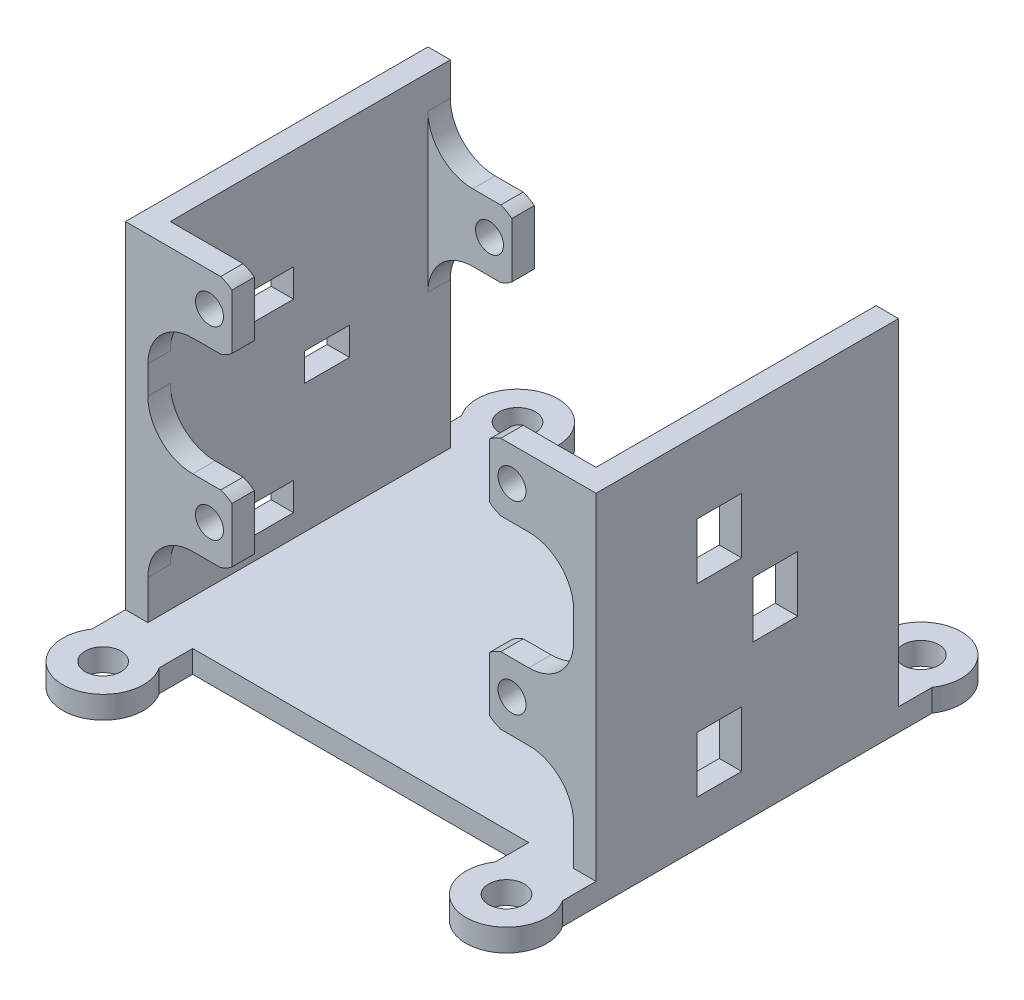
from build123d import *

# Parameters (mm, degrees)
SKETCH_1_W                       = 42
SKETCH_1_H                       = 27
EXTRUDE_1_DEPTH                  = 2
SKETCH_2_W                       = 27
SKETCH_2_H                       = 30
SKETCH_2_W_2                     = 4
SKETCH_2_H_2                     = 5
EXTRUDE_2_DEPTH                  = 2
SKETCH_3_W                       = 4
SKETCH_3_H                       = 2.5
EXTRUDE_3_DEPTH                  = 2
SKETCH_4_R                       = 1.25
EXTRUDE_4_DEPTH                  = 2
PATTERN_LINEAR_1_COUNT           = 2
PATTERN_LINEAR_1_PITCH           = 16.5
PATTERN_LINEAR_1_COPY_1_SKETCH_R = 1.25
PATTERN_LINEAR_1_COPY_1_DEPTH    = 2
PATTERN_LINEAR_2_COUNT           = 2
PATTERN_LINEAR_2_PITCH           = 26.75
PATTERN_LINEAR_2_COPY_1_SKETCH_R = 1.25
PATTERN_LINEAR_2_COPY_1_DEPTH    = 2
FILLET_1_R                       = 4
SKETCH_8_R                       = 1.6
EXTRUDE_5_DEPTH                  = 2
MIRROR_4_COPY_1_SKETCH_R         = 1.6
MIRROR_4_COPY_1_DEPTH            = 2


with BuildPart() as part:
    # Эскиз1 → Бобышка-Вытянуть1 (new body)
    with BuildSketch(Plane(origin=(0, 0, 0), x_dir=(1, 0, 0), z_dir=(0, 1, 0))):
        Rectangle(SKETCH_1_W, SKETCH_1_H)
    extrude(amount=EXTRUDE_1_DEPTH)

    # Эскиз2 → Бобышка-Вытянуть2 (add)
    with BuildSketch(Plane(origin=(21, 0, 0), x_dir=(0, 0, -1), z_dir=(1, 0, 0))):
        with Locations((0, 17)):
            Rectangle(SKETCH_2_W, SKETCH_2_H)
        with Locations((-2.5, 6.5)):
            Rectangle(SKETCH_2_W_2, SKETCH_2_H_2, mode=Mode.SUBTRACT)
        with Locations((2.5, 16)):
            Rectangle(SKETCH_2_W_2, SKETCH_2_H_2, mode=Mode.SUBTRACT)
        with Locations((-2.5, 23)):
            Rectangle(SKETCH_2_W_2, SKETCH_2_H_2, mode=Mode.SUBTRACT)
    extrude_2 = extrude(amount=-EXTRUDE_2_DEPTH)

    # Зеркальное отражение1: Бобышка-Вытянуть2 across plane
    add(extrude_2.mirror(Plane(origin=(0, 0, 0), x_dir=(0, 0, 1), z_dir=(1, 0, 0))))

    # Эскиз3 → Бобышка-Вытянуть3 (add)
    with BuildSketch(Plane.ZY.offset(21)):
        with Locations((2.5, 24.25)):
            Rectangle(SKETCH_3_W, SKETCH_3_H)
        with Locations((-2.5, 17.25)):
            Rectangle(SKETCH_3_W, SKETCH_3_H)
        with Locations((2.5, 7.75)):
            Rectangle(SKETCH_3_W, SKETCH_3_H)
    extrude(amount=-EXTRUDE_3_DEPTH)

    # Эскиз4 → Бобышка-Вытянуть4 (add)
    with BuildSketch(Plane(origin=(0, 0, 13.5), x_dir=(-1, 0, 0), z_dir=(0, 0, -1))):
        with BuildLine():
            Line((-19, 9.5), (-19, 15.5))
            Line((-19, 15.5), (-12.5, 15.5))
            ThreePointArc((-12.5, 15.5), (-11.974953973, 15.270240895), (-11.5, 14.949489743))
            Line((-11.5, 14.949489743), (-11.5, 10.050510257))
            ThreePointArc((-11.5, 10.050510257), (-11.974953973, 9.729759105), (-12.5, 9.5))
            Line((-12.5, 9.5), (-19, 9.5))
        make_face()
        with Locations((-13.5, 12.5)):
            Circle(SKETCH_4_R, mode=Mode.SUBTRACT)
    extrude_4 = extrude(amount=EXTRUDE_4_DEPTH)

    # Зеркальное отражение2: Бобышка-Вытянуть4 across plane
    add(extrude_4.mirror(Plane(origin=(0, 0, 0), x_dir=(0, 0, 1), z_dir=(1, 0, 0))))

    # Линейный массив1: Бобышка-Вытянуть4 ×2
    with Locations(*[(0, i * PATTERN_LINEAR_1_PITCH, 0) for i in range(1, PATTERN_LINEAR_1_COUNT)]):
        add(extrude_4)

    # Линейный массив1 copy 1 sketch → Линейный массив1 copy 1 (add)
    with BuildSketch(Plane(origin=(0, 16.5, 13.5), x_dir=(1, 0, 0), z_dir=(0, 0, -1))):
        with BuildLine():
            Line((-19, -9.5), (-19, -15.5))
            Line((-19, -15.5), (-12.5, -15.5))
            ThreePointArc((-12.5, -15.5), (-11.974953973, -15.270240895), (-11.5, -14.949489743))
            Line((-11.5, -14.949489743), (-11.5, -10.050510257))
            ThreePointArc((-11.5, -10.050510257), (-11.974953973, -9.729759105), (-12.5, -9.5))
            Line((-12.5, -9.5), (-19, -9.5))
        make_face()
        with Locations((-13.5, -12.5)):
            Circle(PATTERN_LINEAR_1_COPY_1_SKETCH_R, mode=Mode.SUBTRACT)
    extrude(amount=PATTERN_LINEAR_1_COPY_1_DEPTH)

    # Линейный массив2: Бобышка-Вытянуть4 ×2
    with Locations(*[Vector(0, 0.3564269900834672, -0.9343231778887005) * (i * PATTERN_LINEAR_2_PITCH) for i in range(1, PATTERN_LINEAR_2_COUNT)]):
        add(extrude_4)

    # Линейный массив2 copy 1 sketch → Линейный массив2 copy 1 (add)
    with BuildSketch(Plane(origin=(0, 9.534421985, -11.493145009), x_dir=(1, 0, 0), z_dir=(0, 0, -1))):
        with BuildLine():
            Line((-19, -9.5), (-19, -15.5))
            Line((-19, -15.5), (-12.5, -15.5))
            ThreePointArc((-12.5, -15.5), (-11.974953973, -15.270240895), (-11.5, -14.949489743))
            Line((-11.5, -14.949489743), (-11.5, -10.050510257))
            ThreePointArc((-11.5, -10.050510257), (-11.974953973, -9.729759105), (-12.5, -9.5))
            Line((-12.5, -9.5), (-19, -9.5))
        make_face()
        with Locations((-13.5, -12.5)):
            Circle(PATTERN_LINEAR_2_COPY_1_SKETCH_R, mode=Mode.SUBTRACT)
    extrude(amount=PATTERN_LINEAR_2_COPY_1_DEPTH)

    # Скругление1
    fillet_1_edges = [part.edges().sort_by_distance(p)[0] for p in [
        (19, 15.5, 12.5),
        (19, 9.5, 12.5),
        (-19, 9.5, 12.5),
        (-19, 15.5, 12.5),
        (-19, 26, 12.5),
        (19, 26, 12.5),
        (-19, 19.034421985, -12.493145009),
        (-19, 25.034421985, -12.493145009),
        (19, 25.034421985, -12.493145009),
        (19, 19.034421985, -12.493145009),
    ]]
    fillet(fillet_1_edges, radius=FILLET_1_R)

    # Эскиз8 → Бобышка-Вытянуть5 (add)
    with BuildSketch(Plane(origin=(0, 0, 0), x_dir=(1, 0, 0), z_dir=(0, 1, 0))):
        with BuildLine():
            Line((-21, 13.5), (-18, 13.493145009))
            Line((-18, 13.493145009), (-15, 13.5))
            Line((-15, 13.5), (-15, 16.493145009))
            ThreePointArc((-15, 16.493145009), (-18, 22.098696284), (-21, 16.493145009))
            Line((-21, 16.493145009), (-21, 13.5))
        make_face()
        with Locations(Location((-18, 18.493145009, 0), (0, 0, 270))):
            Circle(SKETCH_8_R, mode=Mode.SUBTRACT)
    extrude_5 = extrude(amount=EXTRUDE_5_DEPTH)

    # Зеркальное отражение3: Бобышка-Вытянуть5 across plane
    add(extrude_5.mirror(Plane(origin=(0, 0, 0), x_dir=(0, 0, 1), z_dir=(1, 0, 0))))

    # Зеркальное отражение4: Бобышка-Вытянуть5 across plane
    add(extrude_5.mirror(Plane.XY))

    # Зеркальное отражение4 copy 1 sketch → Зеркальное отражение4 copy 1 (add)
    with BuildSketch(Plane(origin=(0, 0, 0), x_dir=(-1, 0, 0), z_dir=(0, 1, 0))):
        with BuildLine():
            Line((-21, 13.5), (-18, 13.493145009))
            Line((-18, 13.493145009), (-15, 13.5))
            Line((-15, 13.5), (-15, 16.493145009))
            ThreePointArc((-15, 16.493145009), (-18, 22.098696284), (-21, 16.493145009))
            Line((-21, 16.493145009), (-21, 13.5))
        make_face()
        with Locations(Location((-18, 18.493145009, 0), (0, 0, 270))):
            Circle(MIRROR_4_COPY_1_SKETCH_R, mode=Mode.SUBTRACT)
    extrude(amount=MIRROR_4_COPY_1_DEPTH)


solid = part.part
